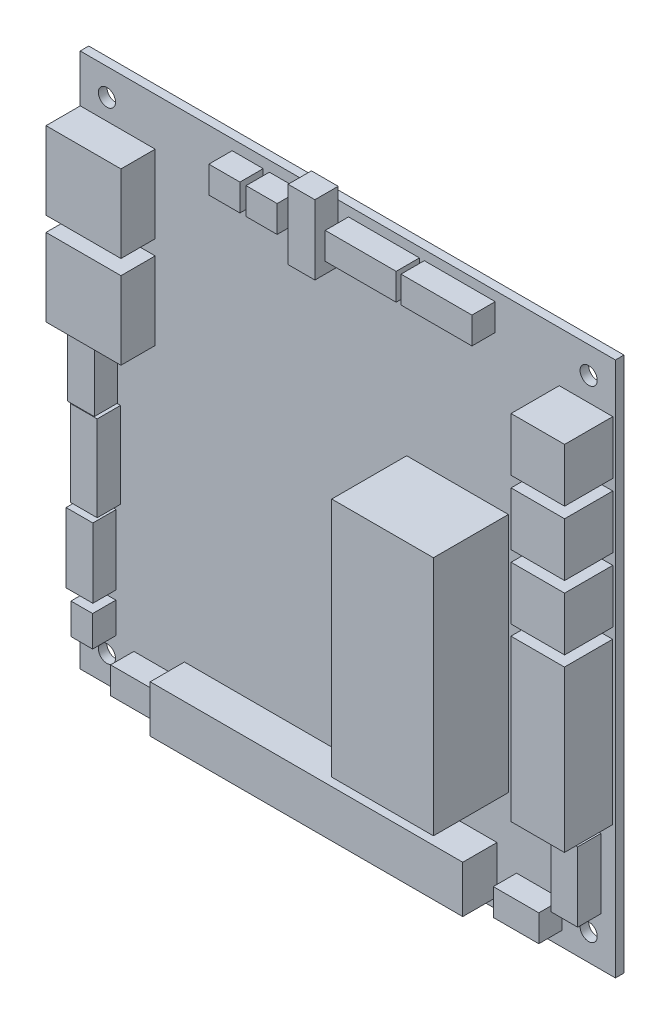
from build123d import *

# Parameters (mm, degrees)
F_100X100_ROTATED_J101_REAR_J801_FRONT_START = 25
SKETCH_1_W                                   = 100
SKETCH_1_H                                   = 100
SKETCH_1_R                                   = 1.6
F_100X100_ROTATED_J101_REAR_J801_FRONT_DEPTH = 1.6
J102_CONNECTOR_ENVELOPE_ROTATED_START        = 26.6
SKETCH_2_W                                   = 10
SKETCH_2_H                                   = 10
J102_CONNECTOR_ENVELOPE_ROTATED_DEPTH        = 9
J201_CONNECTOR_ENVELOPE_ROTATED_START        = 26.6
SKETCH_3_W                                   = 14
SKETCH_3_H                                   = 14.5
J201_CONNECTOR_ENVELOPE_ROTATED_DEPTH        = 6.4
J501_CONNECTOR_ENVELOPE_ROTATED_START        = 26.6
SKETCH_4_W                                   = 14
SKETCH_4_H                                   = 14.5
J501_CONNECTOR_ENVELOPE_ROTATED_DEPTH        = 6.4
J301_CONNECTOR_ENVELOPE_ROTATED_START        = 26.6
SKETCH_5_W                                   = 10
SKETCH_5_H                                   = 10
J301_CONNECTOR_ENVELOPE_ROTATED_DEPTH        = 9
J304_CONNECTOR_ENVELOPE_ROTATED_START        = 26.6
SKETCH_6_W                                   = 10
SKETCH_6_H                                   = 10
J304_CONNECTOR_ENVELOPE_ROTATED_DEPTH        = 9
J302_CONNECTOR_ENVELOPE_ROTATED_START        = 26.6
SKETCH_7_W                                   = 10
SKETCH_7_H                                   = 30
J302_CONNECTOR_ENVELOPE_ROTATED_DEPTH        = 9
J305_CONNECTOR_ENVELOPE_ROTATED_START        = 26.6
SKETCH_8_W                                   = 5.8
SKETCH_8_H                                   = 5
J305_CONNECTOR_ENVELOPE_ROTATED_DEPTH        = 4.35
J306_CONNECTOR_ENVELOPE_ROTATED_START        = 26.6
SKETCH_9_W                                   = 5.8
SKETCH_9_H                                   = 5
J306_CONNECTOR_ENVELOPE_ROTATED_DEPTH        = 4.35
J401_CONNECTOR_ENVELOPE_ROTATED_START        = 26.6
SKETCH_10_W                                  = 5
SKETCH_10_H                                  = 13
J401_CONNECTOR_ENVELOPE_ROTATED_DEPTH        = 4.35
J502_CONNECTOR_ENVELOPE_ROTATED_START        = 26.6
SKETCH_11_W                                  = 5
SKETCH_11_H                                  = 16
J502_CONNECTOR_ENVELOPE_ROTATED_DEPTH        = 4.35
J602_CONNECTOR_ENVELOPE_ROTATED_START        = 26.6
SKETCH_13_W                                  = 5
SKETCH_13_H                                  = 13
J602_CONNECTOR_ENVELOPE_ROTATED_DEPTH        = 4.35
J701_CONNECTOR_ENVELOPE_ROTATED_START        = 26.6
SKETCH_14_W                                  = 5
SKETCH_14_H                                  = 13
J701_CONNECTOR_ENVELOPE_ROTATED_DEPTH        = 4.35
J702_CONNECTOR_ENVELOPE_ROTATED_START        = 26.6
SKETCH_15_W                                  = 13.25
SKETCH_15_H                                  = 5
J702_CONNECTOR_ENVELOPE_ROTATED_DEPTH        = 4.35
J703_CONNECTOR_ENVELOPE_ROTATED_START        = 26.6
SKETCH_16_W                                  = 13.25
SKETCH_16_H                                  = 5
J703_CONNECTOR_ENVELOPE_ROTATED_DEPTH        = 4.35
J704_CONNECTOR_ENVELOPE_ROTATED_START        = 26.6
SKETCH_17_W                                  = 8.5
SKETCH_17_H                                  = 5
J704_CONNECTOR_ENVELOPE_ROTATED_DEPTH        = 4.35
J705_CONNECTOR_ENVELOPE_ROTATED_START        = 26.6
SKETCH_18_W                                  = 5
SKETCH_18_H                                  = 13
J705_CONNECTOR_ENVELOPE_ROTATED_DEPTH        = 4.35
J706_CONNECTOR_ENVELOPE_ROTATED_START        = 26.6
SKETCH_19_W                                  = 8.5
SKETCH_19_H                                  = 5
J706_CONNECTOR_ENVELOPE_ROTATED_DEPTH        = 4.35
J801_CONNECTOR_ENVELOPE_ROTATED_START        = 26.6
SKETCH_20_W                                  = 58.4
SKETCH_20_H                                  = 8.8
J801_CONNECTOR_ENVELOPE_ROTATED_DEPTH        = 6.4
NANO_SOCKET_START                            = 26.6
SKETCH_21_W                                  = 19
SKETCH_21_H                                  = 45
NANO_SOCKET_DEPTH                            = 12.4
NANO_PCB_START                               = 39
SKETCH_22_W                                  = 19
SKETCH_22_H                                  = 45
NANO_PCB_DEPTH                               = 1.6
J601_GH2P_CORRECTED_BODY_REFERENCE_START     = 26.6
SKETCH_23_W                                  = 4.05
SKETCH_23_H                                  = 5.75
J601_GH2P_CORRECTED_BODY_REFERENCE_DEPTH     = 4.35


with BuildPart() as part:
    # 草图1 → 100x100_rotated_J101_rear_J801_front (new body)
    with BuildSketch(Plane.XY.offset(F_100X100_ROTATED_J101_REAR_J801_FRONT_START)):
        with Locations((0, 82)):
            Rectangle(SKETCH_1_W, SKETCH_1_H)
        with Locations((-45, 37)):
            Circle(SKETCH_1_R, mode=Mode.SUBTRACT)
        with Locations((45, 37)):
            Circle(SKETCH_1_R, mode=Mode.SUBTRACT)
        with Locations((45, 127)):
            Circle(SKETCH_1_R, mode=Mode.SUBTRACT)
        with Locations((-45, 127)):
            Circle(SKETCH_1_R, mode=Mode.SUBTRACT)
    extrude(amount=F_100X100_ROTATED_J101_REAR_J801_FRONT_DEPTH)

    # 草图2 → J102_connector_envelope_rotated (add)
    with BuildSketch(Plane.XY.offset(J102_CONNECTOR_ENVELOPE_ROTATED_START)):
        with Locations((44.5045, 117.5895)):
            Rectangle(SKETCH_2_W, SKETCH_2_H)
    extrude(amount=J102_CONNECTOR_ENVELOPE_ROTATED_DEPTH)

    # 草图3 → J201_connector_envelope_rotated (add)
    with BuildSketch(Plane.XY.offset(J201_CONNECTOR_ENVELOPE_ROTATED_START)):
        with Locations((-42.9835, 115.871)):
            Rectangle(SKETCH_3_W, SKETCH_3_H)
    extrude(amount=J201_CONNECTOR_ENVELOPE_ROTATED_DEPTH)

    # 草图4 → J501_connector_envelope_rotated (add)
    with BuildSketch(Plane.XY.offset(J501_CONNECTOR_ENVELOPE_ROTATED_START)):
        with Locations((-42.9835, 98.599)):
            Rectangle(SKETCH_4_W, SKETCH_4_H)
    extrude(amount=J501_CONNECTOR_ENVELOPE_ROTATED_DEPTH)

    # 草图5 → J301_connector_envelope_rotated (add)
    with BuildSketch(Plane.XY.offset(J301_CONNECTOR_ENVELOPE_ROTATED_START)):
        with Locations((44.5045, 93.5225)):
            Rectangle(SKETCH_5_W, SKETCH_5_H)
    extrude(amount=J301_CONNECTOR_ENVELOPE_ROTATED_DEPTH)

    # 草图6 → J304_connector_envelope_rotated (add)
    with BuildSketch(Plane.XY.offset(J304_CONNECTOR_ENVELOPE_ROTATED_START)):
        with Locations((44.5045, 105.5555)):
            Rectangle(SKETCH_6_W, SKETCH_6_H)
    extrude(amount=J304_CONNECTOR_ENVELOPE_ROTATED_DEPTH)

    # 草图7 → J302_connector_envelope_rotated (add)
    with BuildSketch(Plane.XY.offset(J302_CONNECTOR_ENVELOPE_ROTATED_START)):
        with Locations((44.4745, 71.5485)):
            Rectangle(SKETCH_7_W, SKETCH_7_H)
    extrude(amount=J302_CONNECTOR_ENVELOPE_ROTATED_DEPTH)

    # 草图8 → J305_connector_envelope_rotated (add)
    with BuildSketch(Plane.XY.offset(J305_CONNECTOR_ENVELOPE_ROTATED_START)):
        with Locations((-18.7075, 127.555)):
            Rectangle(SKETCH_8_W, SKETCH_8_H)
    extrude(amount=J305_CONNECTOR_ENVELOPE_ROTATED_DEPTH)

    # 草图9 → J306_connector_envelope_rotated (add)
    with BuildSketch(Plane.XY.offset(J306_CONNECTOR_ENVELOPE_ROTATED_START)):
        with Locations((-11.7545, 127.555)):
            Rectangle(SKETCH_9_W, SKETCH_9_H)
    extrude(amount=J306_CONNECTOR_ENVELOPE_ROTATED_DEPTH)

    # 草图10 → J401_connector_envelope_rotated (add)
    with BuildSketch(Plane.XY.offset(J401_CONNECTOR_ENVELOPE_ROTATED_START)):
        with Locations((44.7985, 47.5445)):
            Rectangle(SKETCH_10_W, SKETCH_10_H)
    extrude(amount=J401_CONNECTOR_ENVELOPE_ROTATED_DEPTH)

    # 草图11 → J502_connector_envelope_rotated (add)
    with BuildSketch(Plane.XY.offset(J502_CONNECTOR_ENVELOPE_ROTATED_START)):
        with Locations((-44.972, 70.4055)):
            Rectangle(SKETCH_11_W, SKETCH_11_H)
    extrude(amount=J502_CONNECTOR_ENVELOPE_ROTATED_DEPTH)

    # 草图13 → J602_connector_envelope_rotated (add)
    with BuildSketch(Plane.XY.offset(J602_CONNECTOR_ENVELOPE_ROTATED_START)):
        with Locations((-45.785, 54.6575)):
            Rectangle(SKETCH_13_W, SKETCH_13_H)
    extrude(amount=J602_CONNECTOR_ENVELOPE_ROTATED_DEPTH)

    # 草图14 → J701_connector_envelope_rotated (add)
    with BuildSketch(Plane.XY.offset(J701_CONNECTOR_ENVELOPE_ROTATED_START)):
        with Locations((-45.506, 85.0105)):
            Rectangle(SKETCH_14_W, SKETCH_14_H)
    extrude(amount=J701_CONNECTOR_ENVELOPE_ROTATED_DEPTH)

    # 草图15 → J702_connector_envelope_rotated (add)
    with BuildSketch(Plane.XY.offset(J702_CONNECTOR_ENVELOPE_ROTATED_START)):
        with Locations((6.7595, 127.709)):
            Rectangle(SKETCH_15_W, SKETCH_15_H)
    extrude(amount=J702_CONNECTOR_ENVELOPE_ROTATED_DEPTH)

    # 草图16 → J703_connector_envelope_rotated (add)
    with BuildSketch(Plane.XY.offset(J703_CONNECTOR_ENVELOPE_ROTATED_START)):
        with Locations((20.9175, 127.709)):
            Rectangle(SKETCH_16_W, SKETCH_16_H)
    extrude(amount=J703_CONNECTOR_ENVELOPE_ROTATED_DEPTH)

    # 草图17 → J704_connector_envelope_rotated (add)
    with BuildSketch(Plane.XY.offset(J704_CONNECTOR_ENVELOPE_ROTATED_START)):
        with Locations((-35.7195, 37.359)):
            Rectangle(SKETCH_17_W, SKETCH_17_H)
    extrude(amount=J704_CONNECTOR_ENVELOPE_ROTATED_DEPTH)

    # 草图18 → J705_connector_envelope_rotated (add)
    with BuildSketch(Plane.XY.offset(J705_CONNECTOR_ENVELOPE_ROTATED_START)):
        with Locations((-4.3005, 127.704)):
            Rectangle(SKETCH_18_W, SKETCH_18_H)
    extrude(amount=J705_CONNECTOR_ENVELOPE_ROTATED_DEPTH)

    # 草图19 → J706_connector_envelope_rotated (add)
    with BuildSketch(Plane.XY.offset(J706_CONNECTOR_ENVELOPE_ROTATED_START)):
        with Locations((35.7815, 37.232)):
            Rectangle(SKETCH_19_W, SKETCH_19_H)
    extrude(amount=J706_CONNECTOR_ENVELOPE_ROTATED_DEPTH)

    # 草图20 → J801_connector_envelope_rotated (add)
    with BuildSketch(Plane.XY.offset(J801_CONNECTOR_ENVELOPE_ROTATED_START)):
        with Locations((-1.325, 38.466)):
            Rectangle(SKETCH_20_W, SKETCH_20_H)
    extrude(amount=J801_CONNECTOR_ENVELOPE_ROTATED_DEPTH)

    # 草图21 → Nano_socket (add)
    with BuildSketch(Plane.XY.offset(NANO_SOCKET_START)):
        with Locations((20.5, 74.5)):
            Rectangle(SKETCH_21_W, SKETCH_21_H)
    extrude(amount=NANO_SOCKET_DEPTH)

    # 草图22 → Nano_PCB (add)
    with BuildSketch(Plane.XY.offset(NANO_PCB_START)):
        with Locations((20.5, 74.5)):
            Rectangle(SKETCH_22_W, SKETCH_22_H)
    extrude(amount=NANO_PCB_DEPTH)

    # 草图23 → J601_GH2P_corrected_body_reference (add)
    with BuildSketch(Plane.XY.offset(J601_GH2P_CORRECTED_BODY_REFERENCE_START)):
        with Locations((-45.353, 43.6075)):
            Rectangle(SKETCH_23_W, SKETCH_23_H)
    extrude(amount=J601_GH2P_CORRECTED_BODY_REFERENCE_DEPTH)


solid = part.part
